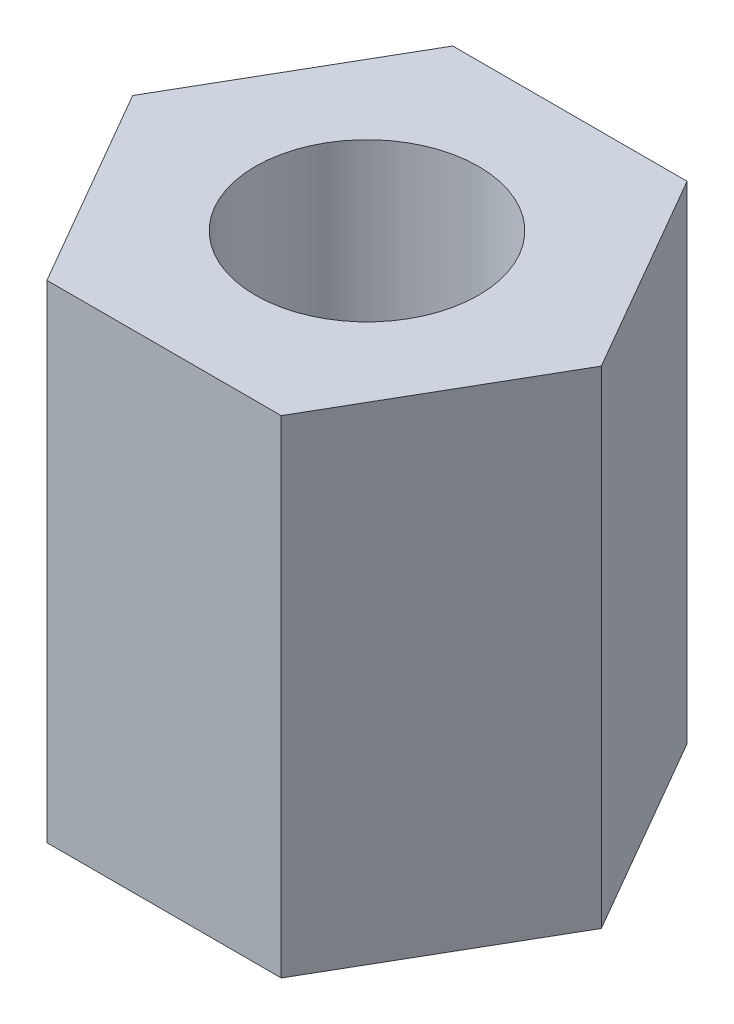
from build123d import *

# Parameters (mm, degrees)
SKETCH1_R           = 1.375
BOSS_EXTRUDE1_DEPTH = 3


with BuildPart() as part:
    # Sketch1 → Boss-Extrude1 (new, symmetric)
    with BuildSketch(Plane(origin=(0, 0, 0), x_dir=(1, 0, 0), z_dir=(0, 1, 0))):
        Polygon((2.886751346, 0), (1.443375673, 2.5), (-1.443375673, 2.5), (-2.886751346, 0), (-1.443375673, -2.5), (1.443375673, -2.5), align=None)
        with Locations(Location((0, 0, 0), (0, 0, 270))):
            Circle(SKETCH1_R, mode=Mode.SUBTRACT)
    extrude(amount=BOSS_EXTRUDE1_DEPTH, both=True)


solid = part.part
